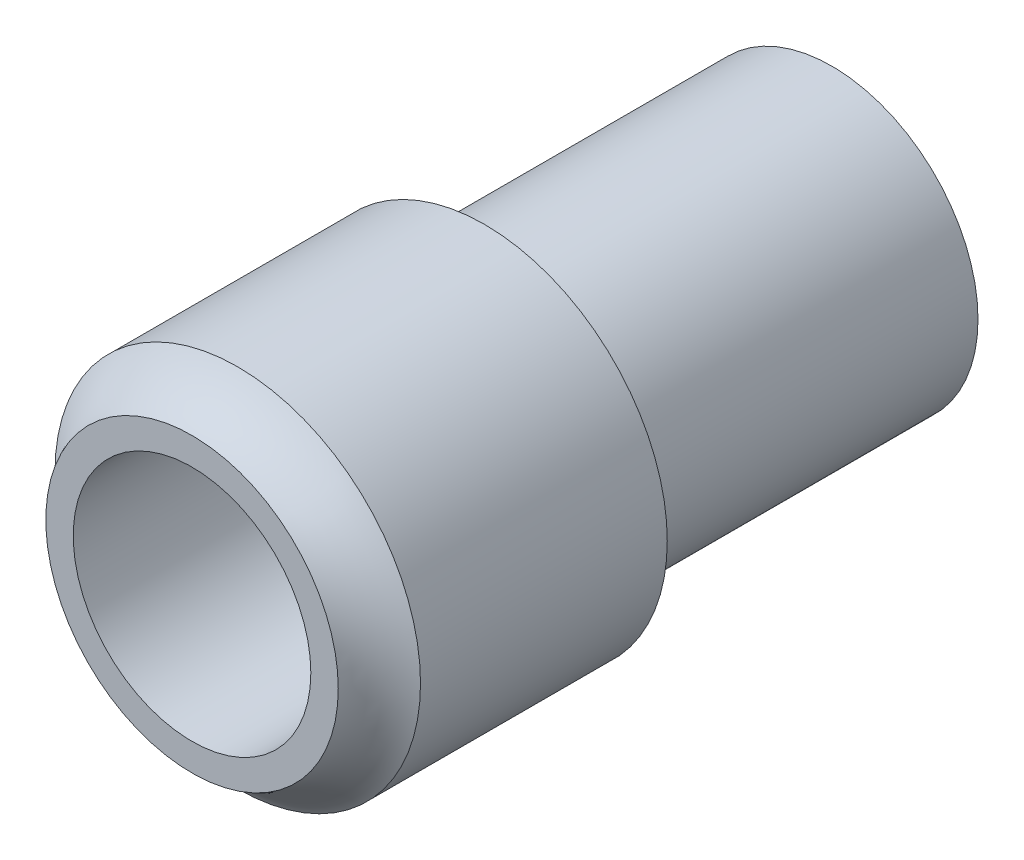
from build123d import *

# Parameters (mm, degrees)
SKETCH_2_R          = 6.5
CUT_EXTRUDE_1_DEPTH = 38.749172176


with BuildPart() as part:
    # Эскиз1 → Повернуть1 (revolve)
    with BuildSketch(Plane(origin=(0, 0, 0), x_dir=(0, 0, -1), z_dir=(1, 0, 0)), mode=Mode.PRIVATE) as revolve_1_sk:
        with BuildLine():
            Line((0, 8), (0, 10))
            Line((0, 10), (-13.5, 10))
            ThreePointArc((-13.5, 10), (-14.58559515, 8.794493938), (-16, 8))
            Line((-16, 8), (-16, 0))
            Line((-16, 0), (19, 0))
            Line((19, 0), (19, 8))
            Line((19, 8), (0, 8))
        make_face()
    revolve(revolve_1_sk.sketch.rotate(Axis((0, 0, 16), (0, 0, -1)), 90), axis=Axis((0, 0, 16), (0, 0, -1)))

    # Эскиз2 → Вырез-Вытянуть1 (cut, through all)
    with BuildSketch(Plane.XY.offset(16)):
        Circle(SKETCH_2_R)
    extrude(amount=-CUT_EXTRUDE_1_DEPTH, mode=Mode.SUBTRACT)


solid = part.part
